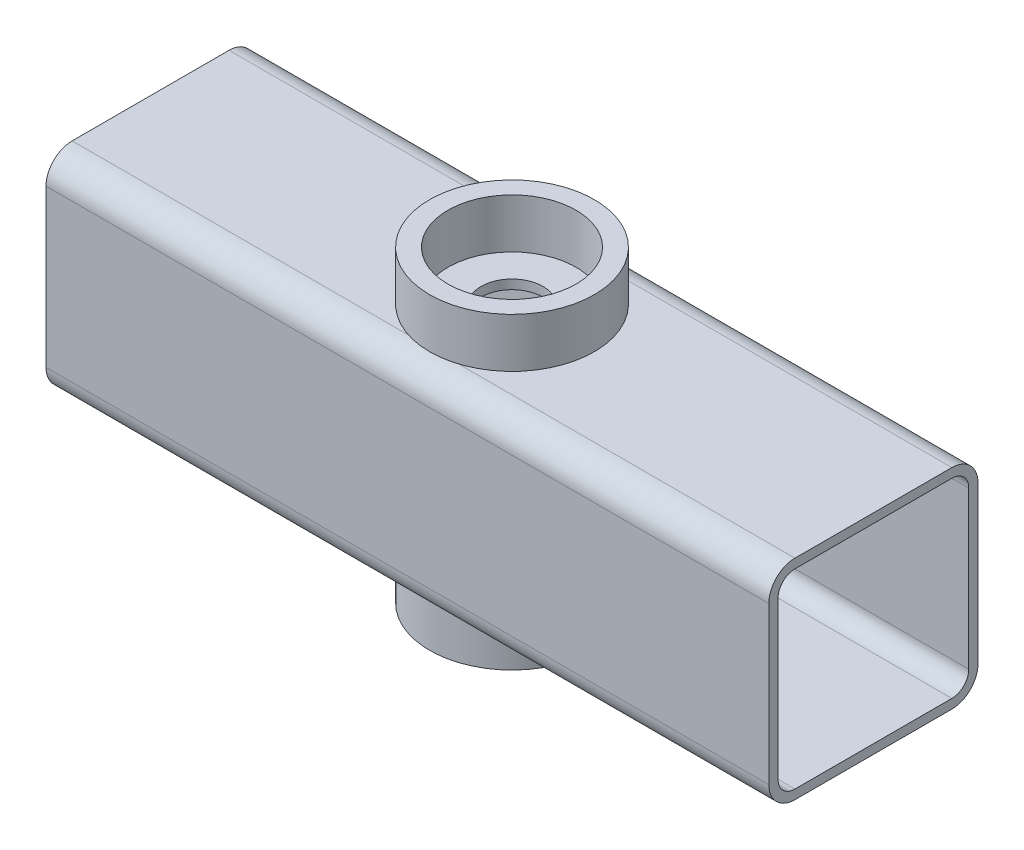
from build123d import *

# Parameters (mm, degrees)
MIEMBRO_ESTRUCTURAL1_DEPTH    = 351
TALADRO_DE_MARGEN_PARA_M391_D = 30
CROQUIS6_R                    = 40
SALIENTE_EXTRUIR1_DEPTH       = 24
CROQUIS7_R                    = 31.1
CORTAR_EXTRUIR1_DEPTH         = 30
CROQUIS8_R                    = 40
SALIENTE_EXTRUIR2_DEPTH       = 24
CROQUIS9_R                    = 31.1
CORTAR_EXTRUIR2_DEPTH         = 30


with BuildPart() as part:
    # Sketch1 → Miembro estructural1 (new body)
    with BuildSketch(Plane.YZ.offset(-178.308765334)):
        with BuildLine():
            Line((-38.1, -50.8), (38.1, -50.8))
            ThreePointArc((38.1, -50.8), (47.080256121, -47.080256121), (50.8, -38.1))
            Line((50.8, -38.1), (50.8, 38.1))
            ThreePointArc((50.8, 38.1), (47.080256121, 47.080256121), (38.1, 50.8))
            Line((38.1, 50.8), (-38.1, 50.8))
            ThreePointArc((-38.1, 50.8), (-47.080256121, 47.080256121), (-50.8, 38.1))
            Line((-50.8, 38.1), (-50.8, -38.1))
            ThreePointArc((-50.8, -38.1), (-47.080256121, -47.080256121), (-38.1, -50.8))
        make_face()
        with BuildLine():
            Line((-38.1, -46.3), (38.1, -46.3))
            ThreePointArc((38.1, -46.3), (43.898275606, -43.898275606), (46.3, -38.1))
            Line((46.3, -38.1), (46.3, 38.1))
            ThreePointArc((46.3, 38.1), (43.898275606, 43.898275606), (38.1, 46.3))
            Line((38.1, 46.3), (-38.1, 46.3))
            ThreePointArc((-38.1, 46.3), (-43.898275606, 43.898275606), (-46.3, 38.1))
            Line((-46.3, 38.1), (-46.3, -38.1))
            ThreePointArc((-46.3, -38.1), (-43.898275606, -43.898275606), (-38.1, -46.3))
        make_face(mode=Mode.SUBTRACT)
    extrude(amount=MIEMBRO_ESTRUCTURAL1_DEPTH)

    # Taladro de margen para M391 (through all)
    with Locations(Plane(origin=(0, 50.8, 0), x_dir=(1, 0, 0), z_dir=(0, 1, 0))):
        with Locations((-2.808765334, 0)):
            Hole(TALADRO_DE_MARGEN_PARA_M391_D / 2)


with BuildPart() as body_2:
    # Croquis6 → Saliente-Extruir1 (new body)
    with BuildSketch(Plane(origin=(0, 50.8, 0), x_dir=(1, 0, 0), z_dir=(0, 1, 0))):
        with Locations(Location((-2.808765334, 0, 0), (0, 0, 270))):
            Circle(CROQUIS6_R)
    extrude(amount=SALIENTE_EXTRUIR1_DEPTH)

    # Croquis7 → Cortar-Extruir1 (cut)
    with BuildSketch(Plane(origin=(0, 74.8, 0), x_dir=(1, 0, 0), z_dir=(0, 1, 0))):
        with Locations(Location((-2.808765334, 0, 0), (0, 0, 270))):
            Circle(CROQUIS7_R)
    extrude(amount=-CORTAR_EXTRUIR1_DEPTH, mode=Mode.SUBTRACT)


with BuildPart() as body_3:
    # Croquis8 → Saliente-Extruir2 (new body)
    with BuildSketch(Plane(origin=(0, -50.8, 0), x_dir=(-1, 0, 0), z_dir=(0, -1, 0))):
        with Locations(Location((2.808765334, 0, 0), (0, 0, 90))):
            Circle(CROQUIS8_R)
    extrude(amount=SALIENTE_EXTRUIR2_DEPTH)

    # Croquis9 → Cortar-Extruir2 (cut)
    with BuildSketch(Plane(origin=(0, -74.8, 0), x_dir=(-1, 0, 0), z_dir=(0, -1, 0))):
        with Locations(Location((2.808765334, 0, 0), (0, 0, 90))):
            Circle(CROQUIS9_R)
    extrude(amount=-CORTAR_EXTRUIR2_DEPTH, mode=Mode.SUBTRACT)


solid = Compound([part.part, body_2.part, body_3.part])
